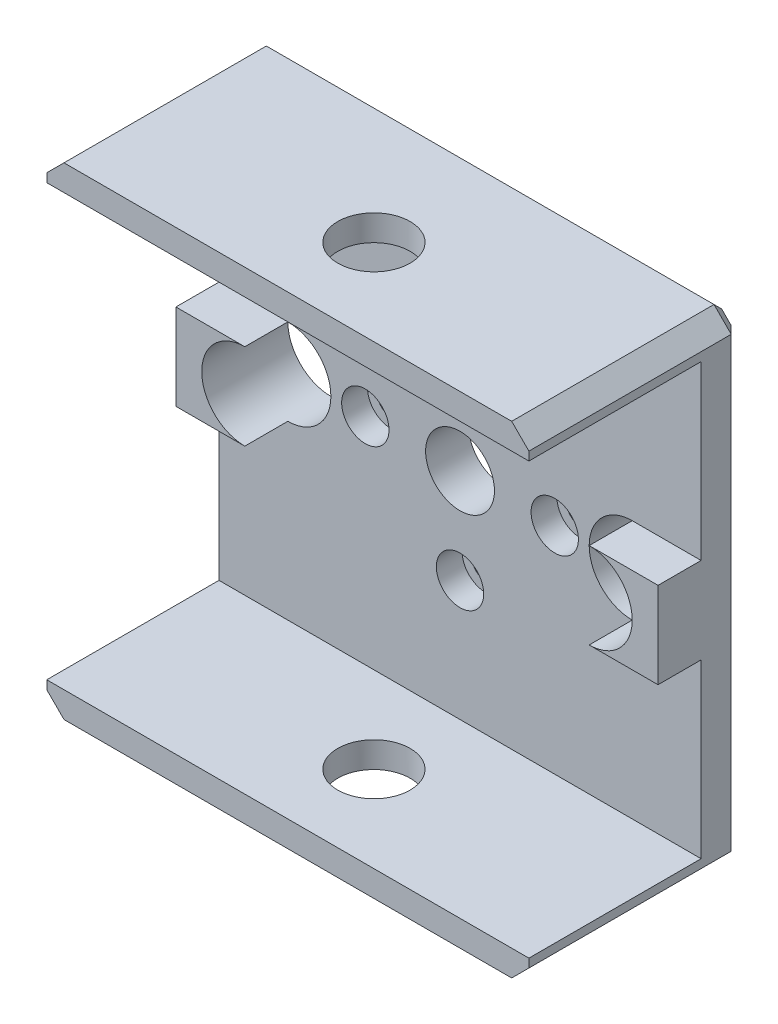
from build123d import *

# Parameters (mm, degrees)
CROQUIS1_W              = 56
CROQUIS1_H              = 56
CROQUIS1_R              = 4
CROQUIS1_R_2            = 1.6
SALIENTE_EXTRUIR1_DEPTH = 5
CROQUIS2_W              = 56
CROQUIS2_H              = 3
SALIENTE_EXTRUIR2_DEPTH = 20
CROQUIS3_R              = 4.2
CORTAR_EXTRUIR1_DEPTH   = 68.416615163
CROQUIS4_R              = 2.75
CORTAR_EXTRUIR2_DEPTH   = 3
CROQUIS7_W              = 8
CROQUIS7_H              = 10
SALIENTE_EXTRUIR3_DEPTH = 5
CROQUIS5_R              = 5
CORTAR_EXTRUIR3_DEPTH   = 47.829477896
CHAFL_N1_SIZE           = 2
CHAFL_N2_SIZE           = 1.5


with BuildPart() as part:
    # Croquis1 → Saliente-Extruir1 (new body)
    with BuildSketch(Plane.XY):
        Rectangle(CROQUIS1_W, CROQUIS1_H)
        Circle(CROQUIS1_R, mode=Mode.SUBTRACT)
        with Locations((0, 11)):
            Circle(CROQUIS1_R_2, mode=Mode.SUBTRACT)
        with Locations((11, 0)):
            Circle(CROQUIS1_R_2, mode=Mode.SUBTRACT)
        with Locations((0, -11)):
            Circle(CROQUIS1_R_2, mode=Mode.SUBTRACT)
        with Locations((-11, 0)):
            Circle(CROQUIS1_R_2, mode=Mode.SUBTRACT)
    extrude(amount=SALIENTE_EXTRUIR1_DEPTH)

    # Croquis2 → Saliente-Extruir2 (add)
    with BuildSketch(Plane.XY.offset(5)):
        with Locations((0, 26.5)):
            Rectangle(CROQUIS2_W, CROQUIS2_H)
        with Locations((0, -26.5)):
            Rectangle(CROQUIS2_W, CROQUIS2_H)
    extrude(amount=SALIENTE_EXTRUIR2_DEPTH)

    # Croquis3 → Cortar-Extruir1 (cut, through all)
    with BuildSketch(Plane(origin=(0, 28, 0), x_dir=(1, 0, 0), z_dir=(0, 1, 0))):
        with Locations(Location((0, -15, 0), (0, 0, 270))):
            Circle(CROQUIS3_R)
    extrude(amount=-CORTAR_EXTRUIR1_DEPTH, mode=Mode.SUBTRACT)

    # Croquis4 → Cortar-Extruir2 (cut)
    with BuildSketch(Plane.XY.offset(5)):
        with Locations((-11, 0)):
            Circle(CROQUIS4_R)
        with Locations((0, 11)):
            Circle(CROQUIS4_R)
        with Locations((11, 0)):
            Circle(CROQUIS4_R)
        with Locations((0, -11)):
            Circle(CROQUIS4_R)
    extrude(amount=-CORTAR_EXTRUIR2_DEPTH, mode=Mode.SUBTRACT)

    # Croquis7 → Saliente-Extruir3 (add)
    with BuildSketch(Plane.XY.offset(5)):
        with Locations((-24, 0)):
            Rectangle(CROQUIS7_W, CROQUIS7_H)
    saliente_extruir3 = extrude(amount=SALIENTE_EXTRUIR3_DEPTH)

    # Simetría2: Saliente-Extruir3 across plane
    add(saliente_extruir3.mirror(Plane(origin=(0, 0, 0), x_dir=(0, 0, 1), z_dir=(1, 0, 0))))

    # Croquis5 → Cortar-Extruir3 (cut, through all)
    with BuildSketch(Plane(origin=(0, 0, 0), x_dir=(-1, 0, 0), z_dir=(0, 0, -1))):
        with Locations((20, 0)):
            Circle(CROQUIS5_R)
    cortar_extruir3 = extrude(amount=-CORTAR_EXTRUIR3_DEPTH, mode=Mode.SUBTRACT)

    # Simetría1: Cortar-Extruir3 across plane
    add(cortar_extruir3.mirror(Plane(origin=(0, 0, 0), x_dir=(0, 0, 1), z_dir=(1, 0, 0))), mode=Mode.SUBTRACT)

    # Chaflán1
    chafl_n1_edges = [part.edges().sort_by_distance(p)[0] for p in [
        (-28, 28, 12.5),
        (28, 28, 12.5),
        (28, -28, 12.5),
        (-28, -28, 12.5),
    ]]
    chamfer(chafl_n1_edges, length=CHAFL_N1_SIZE)

    # Chaflán2
    chafl_n2_edges = [part.edges().sort_by_distance(p)[0] for p in [
        (28, 0, 0),
        (-28, 0, 0),
        (0, 28, 0),
        (0, -28, 0),
        (-27, 27, 0),
        (-27, -27, 0),
        (27, 27, 0),
        (27, -27, 0),
    ]]
    chamfer(chafl_n2_edges, length=CHAFL_N2_SIZE)


solid = part.part
